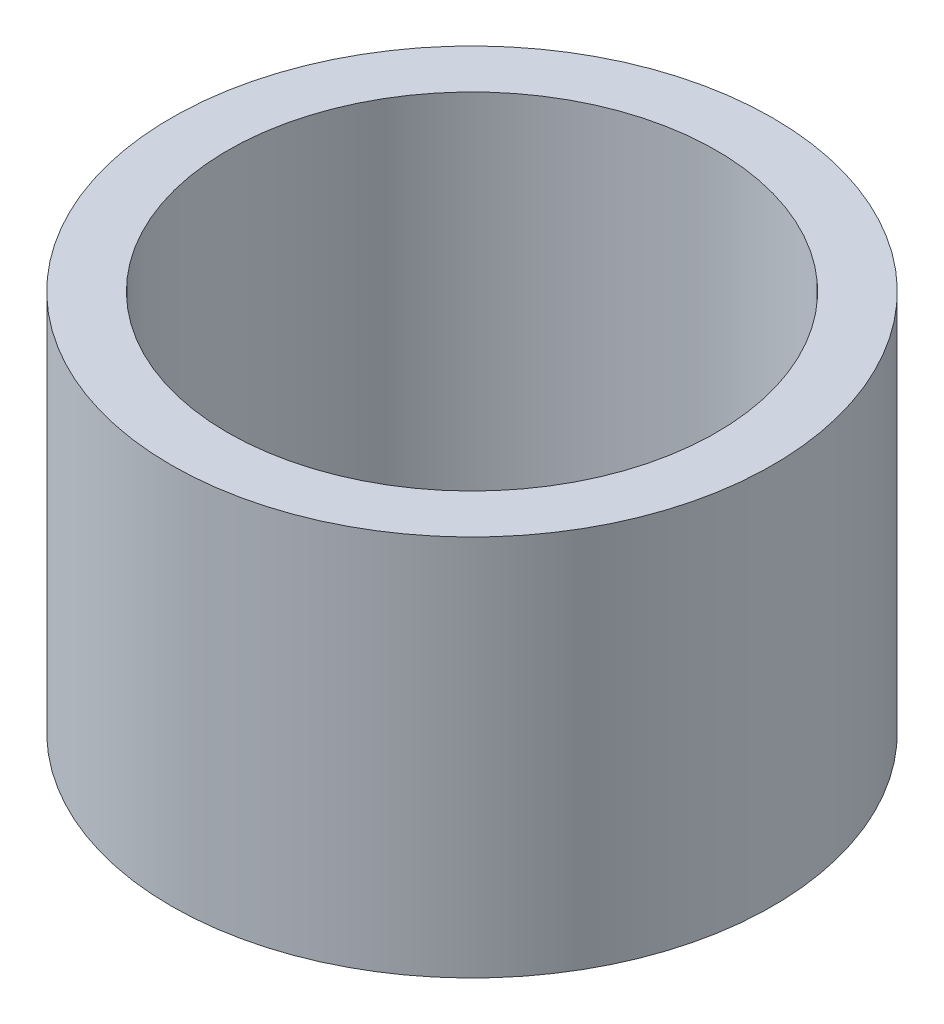
from build123d import *

# Parameters (mm, degrees)
SKETCH1_R           = 5
SKETCH1_R_2         = 4.0635
BOSS_EXTRUDE1_DEPTH = 3.175


with BuildPart() as part:
    # Sketch1 → Boss-Extrude1 (new, symmetric)
    with BuildSketch(Plane(origin=(0, 0, 0), x_dir=(1, 0, 0), z_dir=(0, 1, 0))):
        with Locations(Location((0, 0, 0), (0, 0, 270))):
            Circle(SKETCH1_R)
        with Locations(Location((0, 0, 0), (0, 0, 270))):
            Circle(SKETCH1_R_2, mode=Mode.SUBTRACT)
    extrude(amount=BOSS_EXTRUDE1_DEPTH, both=True)


solid = part.part
